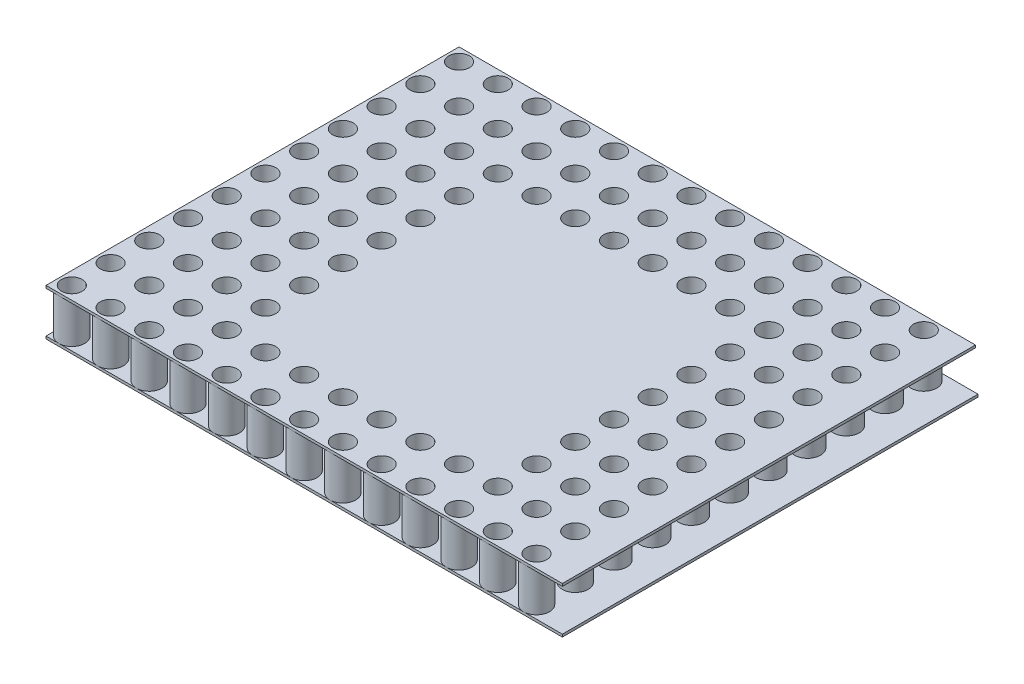
from build123d import *

# Parameters (mm, degrees)
SKETCH1_W              = 20
SKETCH1_H              = 16
BOSS_EXTRUDE1_DEPTH    = 0.1
SKETCH3_W              = 20
SKETCH3_H              = 16.1
BOSS_EXTRUDE3_DEPTH    = 0.1
SKETCH2_R              = 0.5
BOSS_EXTRUDE4_DEPTH    = 1.7
SKETCH2_5_R            = 0.4
CUT_EXTRUDE1_DEPTH     = 44.781651061
LPATTERN1_COUNT        = 11
LPATTERN1_PITCH        = 1.5
LPATTERN1_COUNT_DIR2   = 13
LPATTERN1_PITCH_DIR2   = 1.5
LPATTERN1_2_COUNT      = 11
LPATTERN1_2_PITCH      = 1.5
LPATTERN1_2_COUNT_DIR2 = 13
LPATTERN1_2_PITCH_DIR2 = 1.5


with BuildPart() as part:
    # Sketch1 → Boss-Extrude1 (new body)
    with BuildSketch(Plane(origin=(0, 7.511538426, 0), x_dir=(1, 0, 0), z_dir=(0, 1, 0))):
        with Locations((28.348006291, -13.056433296)):
            Rectangle(SKETCH1_W, SKETCH1_H)
    extrude(amount=BOSS_EXTRUDE1_DEPTH)

    # Sketch2 → Boss-Extrude4 (add)
    with BuildSketch(Plane.XZ.offset(-7.511538426)):
        with Locations(Location((18.848006291, 20.556433296, 0), (0, 0, 90))):
            Circle(SKETCH2_R)
    boss_extrude4 = extrude(amount=BOSS_EXTRUDE4_DEPTH)


with BuildPart() as body_2:
    # Sketch3 → Boss-Extrude3 (new body)
    with BuildSketch(Plane(origin=(0, 5.911538426, 0), x_dir=(-1, 0, 0), z_dir=(0, -1, 0))):
        with Locations((-28.348006291, -13.006433296)):
            Rectangle(SKETCH3_W, SKETCH3_H)
    extrude(amount=BOSS_EXTRUDE3_DEPTH)


with BuildPart() as cut_extrude1_tool:
    # Sketch2<5> → Cut-Extrude1 (new, symmetric)
    with BuildSketch(Plane.XZ.offset(-7.511538426)):
        with Locations(Location((18.848006291, 20.556433296, 0), (0, 0, 270))):
            Circle(SKETCH2_5_R)
    cut_extrude1 = extrude(amount=CUT_EXTRUDE1_DEPTH, both=True)


with BuildPart() as part_1:
    add(part.part)

    # Cut-Extrude1: cut by cut_extrude1_tool
    add(cut_extrude1_tool.part, mode=Mode.SUBTRACT)



with BuildPart() as body_2_1:
    add(body_2.part)

    # Cut-Extrude1: cut by cut_extrude1_tool
    add(cut_extrude1_tool.part, mode=Mode.SUBTRACT)


with BuildPart() as part_2:
    add(part_1.part)

    add(body_2_1.part)  # LPattern1 merges body 2
    # LPattern1: Boss-Extrude4 11 × 13, 36 skipped
    with Locations(*[(j * LPATTERN1_PITCH_DIR2, 0, -i * LPATTERN1_PITCH) for i in range(LPATTERN1_COUNT) for j in range(LPATTERN1_COUNT_DIR2) if (i, j) not in ((0, 0), (2, 4), (2, 5), (2, 6), (2, 7), (2, 8), (2, 9), (3, 4), (3, 5), (3, 6), (3, 7), (3, 8), (3, 9), (4, 4), (4, 5), (4, 6), (4, 7), (4, 8), (4, 9), (5, 4), (5, 5), (5, 6), (5, 7), (5, 8), (5, 9), (6, 4), (6, 5), (6, 6), (6, 7), (6, 8), (6, 9), (7, 4), (7, 5), (7, 6), (7, 7), (7, 8), (7, 9))]):
        add(boss_extrude4)

    # LPattern1 2: Cut-Extrude1 11 × 13, 36 skipped
    with Locations(*[(j * LPATTERN1_2_PITCH_DIR2, 0, -i * LPATTERN1_2_PITCH) for i in range(LPATTERN1_2_COUNT) for j in range(LPATTERN1_2_COUNT_DIR2) if (i, j) not in ((0, 0), (2, 4), (2, 5), (2, 6), (2, 7), (2, 8), (2, 9), (3, 4), (3, 5), (3, 6), (3, 7), (3, 8), (3, 9), (4, 4), (4, 5), (4, 6), (4, 7), (4, 8), (4, 9), (5, 4), (5, 5), (5, 6), (5, 7), (5, 8), (5, 9), (6, 4), (6, 5), (6, 6), (6, 7), (6, 8), (6, 9), (7, 4), (7, 5), (7, 6), (7, 7), (7, 8), (7, 9))]):
        add(cut_extrude1, mode=Mode.SUBTRACT)


solid = part_2.part
